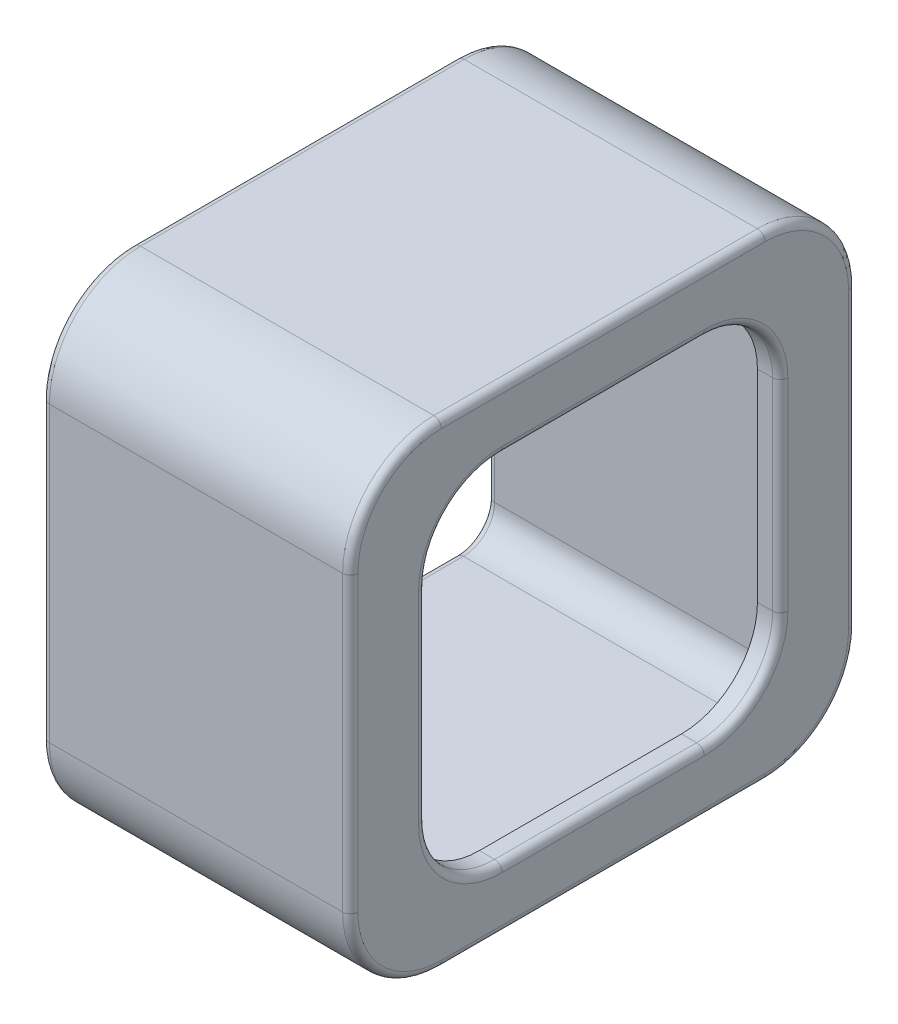
from build123d import *

# Parameters (mm, degrees)
BOSS_EXTRUDE1_DEPTH      = 14.5
BOSS_EXTRUDE1_DEPTH_BACK = 5.8
BOSS_EXTRUDE2_START      = 13
BOSS_EXTRUDE2_DEPTH      = 1.5
FILLET1_R                = 0.5


with BuildPart() as part:
    # Sketch1 → Boss-Extrude1 (new, two sides: drawn at the far end of the back side and taken through both)
    with BuildSketch(Plane(origin=(72.6, 0, 0), x_dir=(0, 0, -1), z_dir=(1, 0, 0)).offset(-BOSS_EXTRUDE1_DEPTH_BACK)):
        with BuildLine():
            Line((-25.65, 22.55), (-4.35, 22.55))
            ThreePointArc((-4.35, 22.55), (-0.107359313, 20.792640687), (1.65, 16.55))
            Line((1.65, 16.55), (1.65, -2.75))
            ThreePointArc((1.65, -2.75), (-0.107359313, -6.992640687), (-4.35, -8.75))
            Line((-4.35, -8.75), (-25.65, -8.75))
            ThreePointArc((-25.65, -8.75), (-29.892640687, -6.992640687), (-31.65, -2.75))
            Line((-31.65, -2.75), (-31.65, 16.55))
            ThreePointArc((-31.65, 16.55), (-29.892640687, 20.792640687), (-25.65, 22.55))
        make_face()
        with BuildLine():
            Line((-25.6, 19.55), (-4.4, 19.55))
            ThreePointArc((-4.4, 19.55), (-2.950431099, 18.949568901), (-2.35, 17.5))
            Line((-2.35, 17.5), (-2.35, -3.7))
            ThreePointArc((-2.35, -3.7), (-2.950431099, -5.149568901), (-4.4, -5.75))
            Line((-4.4, -5.75), (-25.6, -5.75))
            ThreePointArc((-25.6, -5.75), (-27.049568901, -5.149568901), (-27.65, -3.7))
            Line((-27.65, -3.7), (-27.65, 17.5))
            ThreePointArc((-27.65, 17.5), (-27.049568901, 18.949568901), (-25.6, 19.55))
        make_face(mode=Mode.SUBTRACT)
    extrude(amount=BOSS_EXTRUDE1_DEPTH + BOSS_EXTRUDE1_DEPTH_BACK)

    # Sketch1<4> → Boss-Extrude2 (add)
    with BuildSketch(Plane(origin=(72.6, 0, 0), x_dir=(0, 0, -1), z_dir=(1, 0, 0)).offset(BOSS_EXTRUDE2_START)):
        with BuildLine():
            Line((-4.4, 19.55), (-25.6, 19.55))
            ThreePointArc((-25.6, 19.55), (-27.049568901, 18.949568901), (-27.65, 17.5))
            Line((-27.65, 17.5), (-27.65, -3.7))
            ThreePointArc((-27.65, -3.7), (-27.049568901, -5.149568901), (-25.6, -5.75))
            Line((-25.6, -5.75), (-4.4, -5.75))
            ThreePointArc((-4.4, -5.75), (-2.950431099, -5.149568901), (-2.35, -3.7))
            Line((-2.35, -3.7), (-2.35, 17.5))
            ThreePointArc((-2.35, 17.5), (-2.950431099, 18.949568901), (-4.4, 19.55))
        make_face()
        with BuildLine():
            ThreePointArc((-26.65, 13.55), (-25.185533906, 17.085533906), (-21.65, 18.55))
            Line((-21.65, 18.55), (-8.35, 18.55))
            ThreePointArc((-8.35, 18.55), (-4.814466094, 17.085533906), (-3.35, 13.55))
            Line((-3.35, 13.55), (-3.35, 0.25))
            ThreePointArc((-3.35, 0.25), (-4.814466094, -3.285533906), (-8.35, -4.75))
            Line((-8.35, -4.75), (-21.65, -4.75))
            ThreePointArc((-21.65, -4.75), (-25.185533906, -3.285533906), (-26.65, 0.25))
            Line((-26.65, 0.25), (-26.65, 13.55))
        make_face(mode=Mode.SUBTRACT)
    extrude(amount=BOSS_EXTRUDE2_DEPTH)

    # Fillet1
    fillet1_edges = [part.edges().sort_by_distance(p)[0] for p in [
        (66.8, -6.992640687, 29.892640687),
        (66.8, 6.9, 2.35),
        (66.8, 19.55, 15),
        (66.8, 6.9, -1.65),
        (66.8, 18.949568901, 27.049568901),
        (66.8, 6.9, 27.65),
        (87.1, 6.9, -1.65),
        (87.1, 22.55, 15),
        (66.8, -5.149568901, 27.049568901),
        (87.1, 20.792640687, 29.892640687),
        (87.1, 6.9, 31.65),
        (87.1, -6.992640687, 29.892640687),
        (87.1, -8.75, 15),
        (87.1, -6.992640687, 0.107359313),
        (87.1, 20.792640687, 0.107359313),
        (66.8, -5.75, 15),
        (66.8, -5.149568901, 2.950431099),
        (66.8, 18.949568901, 2.950431099),
        (87.1, 6.9, 26.65),
        (87.1, -4.75, 15),
        (87.1, 17.085533906, 25.185533906),
        (87.1, 18.55, 15),
        (87.1, 17.085533906, 4.814466094),
        (87.1, 6.9, 3.35),
        (87.1, -3.285533906, 4.814466094),
        (87.1, -3.285533906, 25.185533906),
        (66.8, 22.55, 15),
        (66.8, 6.9, 31.65),
        (66.8, 20.792640687, 29.892640687),
        (66.8, 20.792640687, 0.107359313),
        (66.8, -6.992640687, 0.107359313),
        (66.8, -8.75, 15),
    ]]
    fillet(fillet1_edges, radius=FILLET1_R)


solid = part.part
